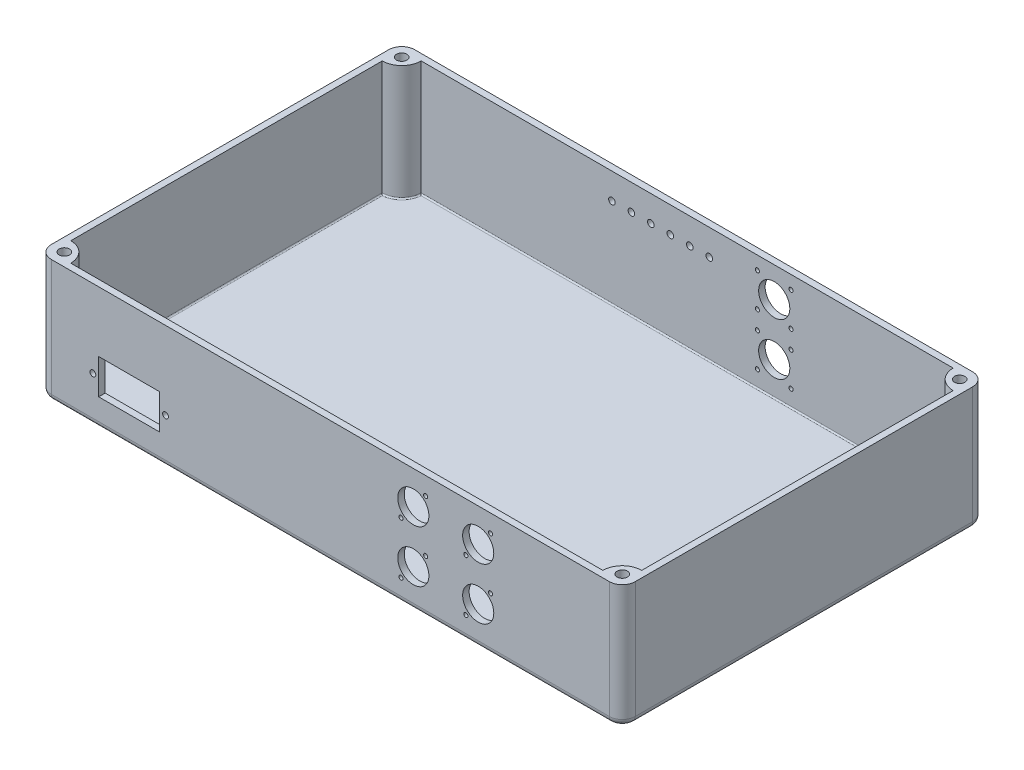
from build123d import *

# Parameters (mm, degrees)
SKETCH1_W               = 450
SKETCH1_H               = 280
BOSS_EXTRUDE1_DEPTH     = 95
FILLET1_R               = 10
FILLET2_R               = 5
CUT_EXTRUDE1_DEPTH      = 89
BOSS_EXTRUDE2_REACH     = 283.514
MIRROR2_COPY_1_REACH    = 283.514
FILLET4_R               = 1
SKETCH7_R               = 4
CUT_EXTRUDE2_DEPTH      = 40
MIRROR4_COPY_1_SKETCH_R = 4
MIRROR4_COPY_1_DEPTH    = 40
SKETCH8_R               = 2.25
SKETCH8_W               = 47
SKETCH8_H               = 26.9
CUT_EXTRUDE3_DEPTH      = 10
SKETCH10_R              = 2.53
SLOTS_FOR_LEDS_DEPTH    = 10
SKETCH11_R              = 12
SKETCH11_R_2            = 1.6
CUT_EXTRUDE4_DEPTH      = 10
SKETCH12_R              = 12
SKETCH12_R_2            = 1.6
CUT_EXTRUDE5_DEPTH      = 10


with BuildPart() as part:
    # Sketch1 → Boss-Extrude1 (new body)
    with BuildSketch(Plane(origin=(0, 0, 0), x_dir=(1, 0, 0), z_dir=(0, 1, 0))):
        Rectangle(SKETCH1_W, SKETCH1_H)
    extrude(amount=BOSS_EXTRUDE1_DEPTH)

    # Fillet1
    fillet1_edges = [part.edges().sort_by_distance(p)[0] for p in [
        (225, 47.5, 140),
        (-225, 47.5, 140),
        (-225, 47.5, -140),
        (225, 47.5, -140),
    ]]
    fillet(fillet1_edges, radius=FILLET1_R)

    # Fillet2
    fillet2_edges = [part.edges().sort_by_distance(p)[0] for p in [
        (-225, 0, 0),
        (225, 0, 0),
        (0, 0, 140),
        (0, 0, -140),
        (-222.071067812, 0, 137.071067812),
        (222.071067812, 0, 137.071067812),
        (222.071067812, 0, -137.071067812),
        (-222.071067812, 0, -137.071067812),
    ]]
    fillet(fillet2_edges, radius=FILLET2_R)

    # Sketch3 → Cut-Extrude1 (cut)
    with BuildSketch(Plane(origin=(0, 95, 0), x_dir=(1, 0, 0), z_dir=(0, 1, 0))):
        with BuildLine():
            Line((220, -130), (220, 130))
            ThreePointArc((220, 130), (218.535533906, 133.535533906), (215, 135))
            Line((215, 135), (-215, 135))
            ThreePointArc((-215, 135), (-218.535533906, 133.535533906), (-220, 130))
            Line((-220, 130), (-220, -130))
            ThreePointArc((-220, -130), (-218.535533906, -133.535533906), (-215, -135))
            Line((-215, -135), (215, -135))
            ThreePointArc((215, -135), (218.535533906, -133.535533906), (220, -130))
        make_face()
    extrude(amount=-CUT_EXTRUDE1_DEPTH, mode=Mode.SUBTRACT)

    # Sketch5 → Boss-Extrude2 (add, up to next)
    with BuildSketch(Plane(origin=(0, 95, 0), x_dir=(1, 0, 0), z_dir=(0, 1, 0)), mode=Mode.PRIVATE) as boss_extrude2_sk1:
        with BuildLine():
            Line((-205, 135), (-215, 135))
            ThreePointArc((-215, 135), (-218.535533906, 133.535533906), (-220, 130))
            Line((-220, 130), (-220, 120))
            ThreePointArc((-220, 120), (-209.393398282, 124.393398282), (-205, 135))
        make_face()
    boss_extrude2_tool1 = extrude(boss_extrude2_sk1.sketch, amount=-BOSS_EXTRUDE2_REACH, mode=Mode.PRIVATE) - part.part
    boss_extrude2 = boss_extrude2_tool1.solids().sort_by_distance((-213.469442, 95, -128.469442))[0]
    add(boss_extrude2)

    # Mirror1: Boss-Extrude2 across plane
    add(boss_extrude2.mirror(Plane.XY))

    # Mirror2: Boss-Extrude2 across plane
    add(boss_extrude2.mirror(Plane(origin=(0, 0, 0), x_dir=(0, 0, 1), z_dir=(1, 0, 0))))

    # Mirror2 copy 1 sketch → Mirror2 copy 1 (add, up to next)
    with BuildSketch(Plane(origin=(0, 95, 0), x_dir=(-1, 0, 0), z_dir=(0, 1, 0)), mode=Mode.PRIVATE) as mirror2_copy_1_sk1:
        with BuildLine():
            Line((-205, 135), (-215, 135))
            ThreePointArc((-215, 135), (-218.535533906, 133.535533906), (-220, 130))
            Line((-220, 130), (-220, 120))
            ThreePointArc((-220, 120), (-209.393398282, 124.393398282), (-205, 135))
        make_face()
    mirror2_copy_1_tool1 = extrude(mirror2_copy_1_sk1.sketch, amount=-MIRROR2_COPY_1_REACH, mode=Mode.PRIVATE) - part.part
    add(mirror2_copy_1_tool1.solids().sort_by_distance((213.469442, 95, 128.469442))[0])

    # Fillet4
    fillet4_edges = [part.edges().sort_by_distance(p)[0] for p in [
        (-220, 6, 0),
        (-209.393398282, 6, 124.393398282),
        (0, 6, 135),
        (209.393398282, 6, 124.393398282),
        (220, 6, 0),
        (209.393398282, 6, -124.393398282),
        (0, 6, -135),
        (-209.393398282, 6, -124.393398282),
    ]]
    fillet(fillet4_edges, radius=FILLET4_R)

    # Sketch7 → Cut-Extrude2 (cut)
    with BuildSketch(Plane(origin=(0, 95, 0), x_dir=(1, 0, 0), z_dir=(0, 1, 0))):
        with Locations(Location((-215, 130, 0), (0, 0, 270))):
            Circle(SKETCH7_R)
    cut_extrude2 = extrude(amount=-CUT_EXTRUDE2_DEPTH, mode=Mode.SUBTRACT)

    # Mirror3: Cut-Extrude2 across plane
    add(cut_extrude2.mirror(Plane.XY), mode=Mode.SUBTRACT)

    # Mirror4: Cut-Extrude2 across plane
    add(cut_extrude2.mirror(Plane(origin=(0, 0, 0), x_dir=(0, 0, 1), z_dir=(1, 0, 0))), mode=Mode.SUBTRACT)

    # Mirror4 copy 1 sketch → Mirror4 copy 1 (cut)
    with BuildSketch(Plane(origin=(0, 95, 0), x_dir=(-1, 0, 0), z_dir=(0, 1, 0))):
        with Locations(Location((-215, 130, 0), (0, 0, 270))):
            Circle(MIRROR4_COPY_1_SKETCH_R)
    extrude(amount=-MIRROR4_COPY_1_DEPTH, mode=Mode.SUBTRACT)

    # Sketch8 → Cut-Extrude3 (cut)
    with BuildSketch(Plane.XY.offset(140)):
        with Locations((-183, 35)):
            Circle(SKETCH8_R)
        with Locations((-127, 35)):
            Circle(SKETCH8_R)
        with Locations((-155, 35)):
            Rectangle(SKETCH8_W, SKETCH8_H)
    extrude(amount=-CUT_EXTRUDE3_DEPTH, mode=Mode.SUBTRACT)

    # Sketch10 → Slots for LEDs (cut)
    with BuildSketch(Plane(origin=(0, 0, -140), x_dir=(-1, 0, 0), z_dir=(0, 0, -1))):
        with Locations((-17, 75)):
            Circle(SKETCH10_R)
        with Locations((-2, 75)):
            Circle(SKETCH10_R)
        with Locations((13, 75)):
            Circle(SKETCH10_R)
        with Locations((28, 75)):
            Circle(SKETCH10_R)
        with Locations((43, 75)):
            Circle(SKETCH10_R)
        with Locations((58, 75)):
            Circle(SKETCH10_R)
    extrude(amount=-SLOTS_FOR_LEDS_DEPTH, mode=Mode.SUBTRACT)

    # Sketch11 → Cut-Extrude4 (cut)
    with BuildSketch(Plane.XY.offset(140)):
        with Locations((63.955734546, 69.39400536)):
            Circle(SKETCH11_R)
        with Locations((73.455734546, 41.39400536)):
            Circle(SKETCH11_R_2)
        with Locations((54.455734546, 17.39400536)):
            Circle(SKETCH11_R_2)
        with Locations((113.955734546, 69.39400536)):
            Circle(SKETCH11_R)
        with Locations((113.955734546, 29.39400536)):
            Circle(SKETCH11_R)
        with Locations((63.955734546, 29.39400536)):
            Circle(SKETCH11_R)
        with Locations((73.455734546, 81.39400536)):
            Circle(SKETCH11_R_2)
        with Locations((54.455734546, 57.39400536)):
            Circle(SKETCH11_R_2)
        with Locations((123.455734546, 41.39400536)):
            Circle(SKETCH11_R_2)
        with Locations((104.455734546, 17.39400536)):
            Circle(SKETCH11_R_2)
        with Locations((123.455734546, 81.39400536)):
            Circle(SKETCH11_R_2)
        with Locations((104.455734546, 57.39400536)):
            Circle(SKETCH11_R_2)
    extrude(amount=-CUT_EXTRUDE4_DEPTH, mode=Mode.SUBTRACT)

    # Sketch12 → Cut-Extrude5 (cut)
    with BuildSketch(Plane(origin=(0, 0, -140), x_dir=(-1, 0, 0), z_dir=(0, 0, -1))):
        with Locations((-67.078371633, 71.762757401)):
            Circle(SKETCH12_R)
        with Locations((-80.078371633, 84.762757401)):
            Circle(SKETCH12_R_2)
        with Locations((-54.078371633, 58.762757401)):
            Circle(SKETCH12_R_2)
        with Locations((-80.078371633, 44.762757401)):
            Circle(SKETCH12_R_2)
        with Locations((-67.078371633, 31.762757401)):
            Circle(SKETCH12_R)
        with Locations((-54.078371633, 18.762757401)):
            Circle(SKETCH12_R_2)
        with Locations((-54.078371633, 84.762757401)):
            Circle(SKETCH12_R_2)
        with Locations((-80.078371633, 58.762757401)):
            Circle(SKETCH12_R_2)
        with Locations((-54.078371633, 44.762757401)):
            Circle(SKETCH12_R_2)
        with Locations((-80.078371633, 18.762757401)):
            Circle(SKETCH12_R_2)
    extrude(amount=-CUT_EXTRUDE5_DEPTH, mode=Mode.SUBTRACT)


solid = part.part
